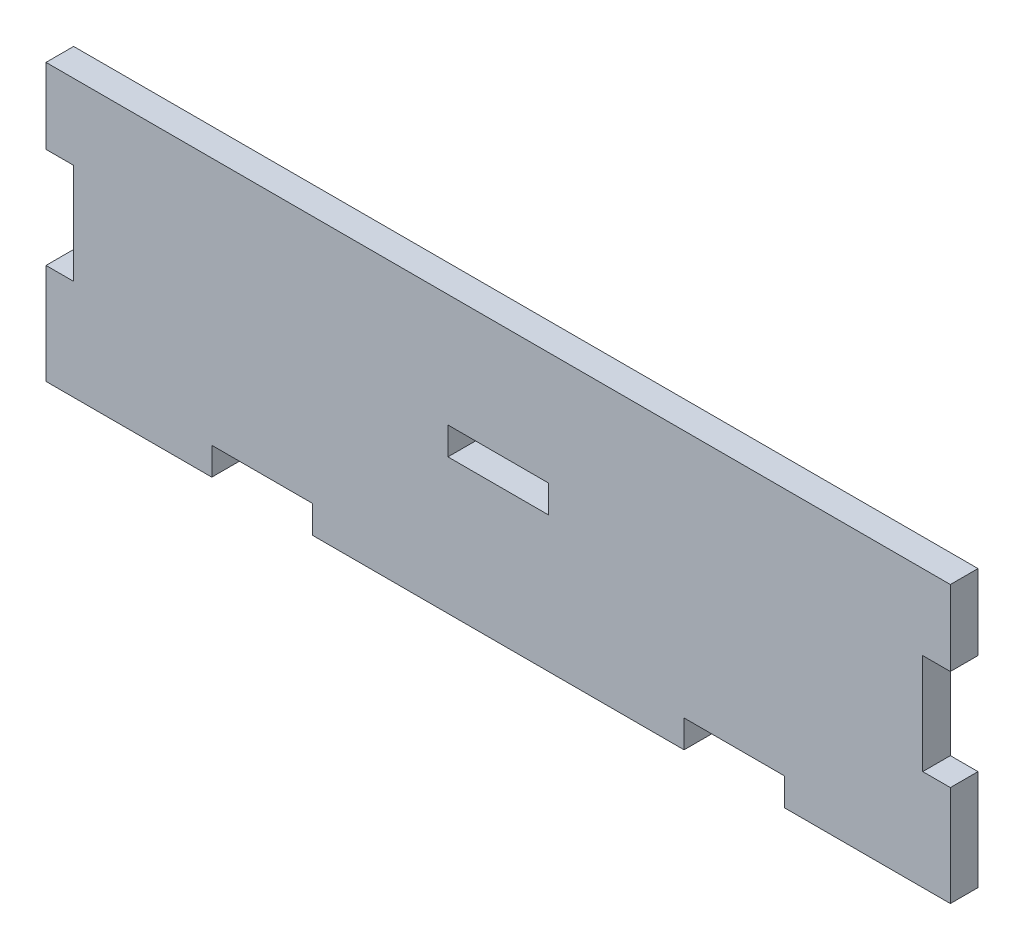
from build123d import *

# Parameters (mm, degrees)
BOSS_EXTRUDE1_DEPTH = 5.5
SKETCH3_W           = 20
SKETCH3_H           = 5.5
CUT_EXTRUDE2_DEPTH  = 5.5


with BuildPart() as part:
    # Sketch1 → Boss-Extrude1 (new body)
    with BuildSketch(Plane.XY):
        Polygon((0, 0), (33, 0), (33, 5.5), (53, 5.5), (53, 0), (127, 0), (127, 5.5), (147, 5.5), (147, 0), (180, 0), (180, 20), (174.5, 20), (174.5, 40), (180, 40), (180, 55), (0, 55), (0, 40), (5.5, 40), (5.5, 20), (0, 20), align=None)
    extrude(amount=BOSS_EXTRUDE1_DEPTH)

    # Sketch3 → Cut-Extrude2 (cut)
    with BuildSketch(Plane.XY.offset(5.5)):
        with Locations((90, 29.75)):
            Rectangle(SKETCH3_W, SKETCH3_H)
    extrude(amount=-CUT_EXTRUDE2_DEPTH, mode=Mode.SUBTRACT)


solid = part.part
